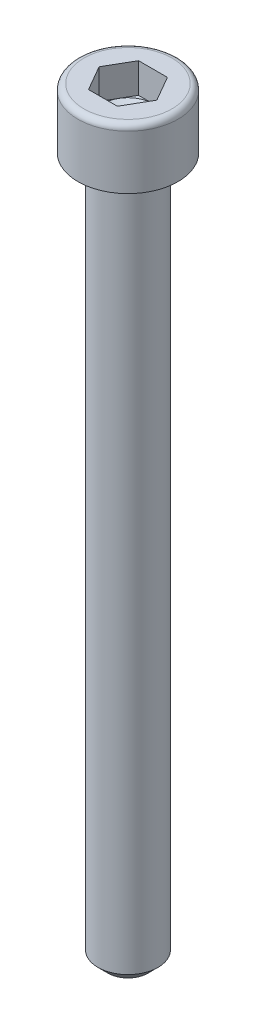
from build123d import *

# Parameters (mm, degrees)
ESQUISSE1_R             = 3
TIGE_DEPTH              = 70
CHANFREIN_D_ENTR_E_SIZE = 1
HEXAGONE_DEPTH          = 3


with BuildPart() as part:
    # Esquisse1 → Tige (new body)
    with BuildSketch(Plane(origin=(0, 0, 0), x_dir=(1, 0, 0), z_dir=(0, 1, 0))):
        Circle(ESQUISSE1_R)
    extrude(amount=-TIGE_DEPTH)

    # Chanfrein d'entrée
    chanfrein_d_entr_e_edges = [part.edges().sort_by_distance(p)[0] for p in [
        (-3, -70, 0),
    ]]
    chamfer(chanfrein_d_entr_e_edges, length=CHANFREIN_D_ENTR_E_SIZE)

    # Esquisse2 → Tête (revolve)
    with BuildSketch(Plane.XY):
        with BuildLine():
            Line((2.5, 6), (2.5, 3))
            Line((2.5, 3), (0, 1.556624327))
            Line((0, 1.556624327), (0, 0))
            Line((0, 0), (5, 0))
            Line((5, 0), (5, 5.4))
            ThreePointArc((5, 5.4), (4.824264069, 5.824264069), (4.4, 6))
            Line((4.4, 6), (2.5, 6))
        make_face()
    revolve(axis=Axis((0, 6, 0), (0, -1, 0)))

    # Esquisse3 → Hexagone (cut)
    with BuildSketch(Plane(origin=(0, 6, -3), x_dir=(1, 0, 0), z_dir=(0, -1, 0))):
        Polygon((1.443375673, 5.5), (-1.443375673, 5.5), (-2.886751346, 3), (-1.443375673, 0.5), (1.443375673, 0.5), (2.886751346, 3), align=None)
    extrude(amount=HEXAGONE_DEPTH, mode=Mode.SUBTRACT)


solid = part.part
